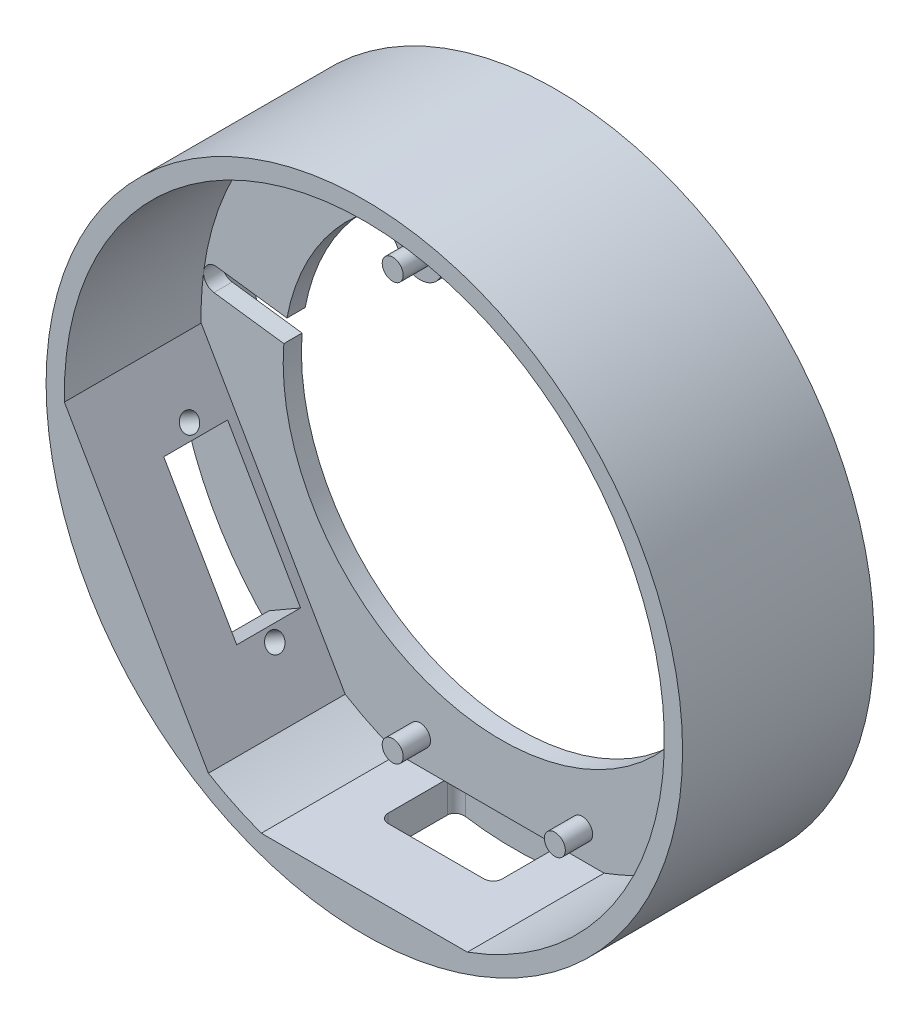
from build123d import *
from build123d.topology import SkipClean

# Parameters (mm, degrees)
ESQUISSE_SUPPORT_R           = 34.9
BOSS_EXTRU_1_DEPTH           = 2
ESQUISSE6_R                  = 1.15
BOSS_EXTRU_2_DEPTH           = 3
BOSS_EXTRU_3_START           = 4
ESQUISSE7_R                  = 34.9
ESQUISSE7_R_2                = 32.9
BOSS_EXTRU_3_DEPTH           = 4
ESQUISSE8_R                  = 34.9
BOSS_EXTRU_5_DEPTH           = 15
ENL_V_MAT_EXTRU_1_DEPTH      = 10
BOSS_EXTRU_6_DEPTH           = 15
ESQUISSE10_R                 = 1
ESQUISSE10_W                 = 7
ESQUISSE10_H                 = 16
ENL_V_MAT_EXTRU_2_DEPTH      = 80.435952156
ENL_V_MAT_EXTRU_3_DEPTH      = 60.597051983
ENL_V_MAT_EXTRU_3_DEPTH_BACK = 60.597051983
ESQUISSE12_W                 = 5
ESQUISSE12_H                 = 7


with BuildPart() as part:
    # Esquisse_support → Boss.-Extru.1 (new body)
    with BuildSketch(Plane.XY):
        Circle(ESQUISSE_SUPPORT_R)
        with BuildLine():
            ThreePointArc((-6.559988321, 18.766115653), (-6.450497051, 21.686422251), (-4.183806862, 23.530953235))
            ThreePointArc((-4.183806862, 23.530953235), (0, 23.9), (4.183806862, 23.530953235))
            ThreePointArc((4.183806862, 23.530953235), (6.450497051, 21.686422251), (6.559988321, 18.766115653))
            ThreePointArc((6.559988321, 18.766115653), (7.983884347, 15.529988321), (11.220011679, 16.953884347))
            Line((11.220011679, 16.953884347), (13.517895322, 19.709807357))
            Line((13.517895322, 19.709807357), (18.243699169, 25.871764581))
            ThreePointArc((18.243699169, 25.871764581), (19.084157828, 26.35728211), (20.021764581, 26.106300831))
            ThreePointArc((20.021764581, 26.106300831), (20.50728211, 25.265842172), (20.256300831, 24.328235419))
            Line((20.256300831, 24.328235419), (15.530496983, 18.166278195))
            ThreePointArc((15.530496983, 18.166278195), (23.692512492, 3.142427693), (19.729143793, -13.489658454))
            Line((19.729143793, -13.489658454), (25.863736665, -18.195211742))
            ThreePointArc((25.863736665, -18.195211742), (26.362962372, -19.059550784), (26.104788258, -20.023736665))
            ThreePointArc((26.104788258, -20.023736665), (25.240449216, -20.522962372), (24.276263335, -20.264788258))
            Line((24.276263335, -20.264788258), (18.141670463, -15.559234969))
            ThreePointArc((18.141670463, -15.559234969), (-9.148411266, -22.079777429), (-23.829761597, 1.830973023))
            Line((-23.829761597, 1.830973023), (-31.491348477, 2.843711519))
            ThreePointArc((-31.491348477, 2.843711519), (-32.357776046, 3.344547295), (-32.616288481, 4.311348477))
            ThreePointArc((-32.616288481, 4.311348477), (-32.115452705, 5.177776046), (-31.148651523, 5.436288481))
            Line((-31.148651523, 5.436288481), (-23.487064643, 4.423549986))
            ThreePointArc((-23.487064643, 4.423549986), (-20.799295594, 11.772820511), (-15.881763126, 17.86))
            ThreePointArc((-15.881763126, 17.86), (-13.316845537, 18.611032405), (-11.220011679, 16.953884347))
            ThreePointArc((-11.220011679, 16.953884347), (-7.983884347, 15.529988321), (-6.559988321, 18.766115653))
        make_face(mode=Mode.SUBTRACT)
    extrude(amount=BOSS_EXTRU_1_DEPTH)

    # Esquisse6 → Boss.-Extru.2 (add)
    with BuildSketch(Plane.XY.offset(2)):
        with Locations((-8.89, 17.86)):
            Circle(ESQUISSE6_R)
        with Locations((-8.89, -27.86)):
            Circle(ESQUISSE6_R)
        with Locations(Location((8.89, -27.86, 0), (0, 0, 180))):
            Circle(ESQUISSE6_R)
        with Locations(Location((8.89, 17.86, 0), (0, 0, 180))):
            Circle(ESQUISSE6_R)
    extrude(amount=BOSS_EXTRU_2_DEPTH)

    # Esquisse7 → Boss.-Extru.3 (add)
    with BuildSketch(Plane(origin=(0, 0, 0), x_dir=(-1, 0, 0), z_dir=(0, 0, -1)).offset(BOSS_EXTRU_3_START)):
        Circle(ESQUISSE7_R)
        with Locations(Location((0, 0, 0), (0, 0, 217.490091077))):
            Circle(ESQUISSE7_R_2, mode=Mode.SUBTRACT)
    extrude(amount=-BOSS_EXTRU_3_DEPTH)

    # Esquisse8 → Boss.-Extru.5 (add)
    with BuildSketch(Plane.XY.offset(2)):
        with Locations(Location((0, 0, 0), (0, 0, 180))):
            Circle(ESQUISSE8_R)
        with BuildLine():
            Line((-11.296016997, -30.9), (11.296016997, -30.9))
            ThreePointArc((11.296016997, -30.9), (0, 32.9), (-11.296016997, -30.9))
        make_face(mode=Mode.SUBTRACT)
    extrude(amount=BOSS_EXTRU_5_DEPTH)

    # Ouverture_USB → Enlèv. mat.-Extru.1 (cut)
    with SkipClean():  # the faces are left unmerged after this step: merging them gives an invalid solid
        with BuildSketch(Plane(origin=(0, -30.9, 0), x_dir=(1, 0, 0), z_dir=(0, 1, 0))):
            with BuildLine():
                Line((-5.25, -9.13), (5.25, -9.13))
                ThreePointArc((5.25, -9.13), (5.957106781, -8.837106781), (6.25, -8.13))
                Line((6.25, -8.13), (6.25, -1.63))
                ThreePointArc((6.25, -1.63), (5.957106781, -0.922893219), (5.25, -0.63))
                Line((5.25, -0.63), (-5.25, -0.63))
                ThreePointArc((-5.25, -0.63), (-5.957106781, -0.922893219), (-6.25, -1.63))
                Line((-6.25, -1.63), (-6.25, -8.13))
                ThreePointArc((-6.25, -8.13), (-5.957106781, -8.837106781), (-5.25, -9.13))
            make_face()
        extrude(amount=-ENL_V_MAT_EXTRU_1_DEPTH, mode=Mode.SUBTRACT)

    # Esquisse9 → Boss.-Extru.6 (add, through all)
    with SkipClean():  # the faces are left unmerged after this step: merging them gives an invalid solid
        with BuildSketch(Plane.XY.offset(2)):
            with BuildLine():
                Line((-17.100090688, -28.106883471), (-32.891320451, -0.755671208))
                ThreePointArc((-32.891320451, -0.755671208), (-28.492235785, -16.45), (-17.100090688, -28.106883471))
            make_face()
        extrude(amount=BOSS_EXTRU_6_DEPTH)

    # Esquisse10 → Enlèv. mat.-Extru.2 (cut, through all)
    with SkipClean():  # the faces are left unmerged after this step: merging them gives an invalid solid
        with BuildSketch(Plane(origin=(-24.99570557, -14.431277339, 0), x_dir=(0, 0, -1), z_dir=(0.8660254037844363, 0.5000000000000042, 0))):
            with Locations(Location((-6.5, -9.35, 0), (0, 0, 90))):
                Circle(ESQUISSE10_R)
            with Locations(Location((-6.5, 9.35, 0), (0, 0, 90))):
                Circle(ESQUISSE10_R)
            with Locations((-6.5, 0)):
                Rectangle(ESQUISSE10_W, ESQUISSE10_H)
        extrude(amount=-ENL_V_MAT_EXTRU_2_DEPTH, mode=Mode.SUBTRACT)

    # Esquisse12 → Enlèv. mat.-Extru.3 (cut, two sides: drawn at the far end of the back side and taken through both)
    with SkipClean():  # the faces are left unmerged after this step: merging them gives an invalid solid
        with BuildSketch(Plane(origin=(-4, 6.92820323, 0), x_dir=(0.8660254037844364, 0.5000000000000041, 0), z_dir=(0.5000000000000041, -0.8660254037844364, 0)).offset(-ENL_V_MAT_EXTRU_3_DEPTH_BACK)):
            with Locations((-35.362554679, 6.5)):
                Rectangle(ESQUISSE12_W, ESQUISSE12_H)
        extrude(amount=ENL_V_MAT_EXTRU_3_DEPTH + ENL_V_MAT_EXTRU_3_DEPTH_BACK, mode=Mode.SUBTRACT)


solid = part.part
